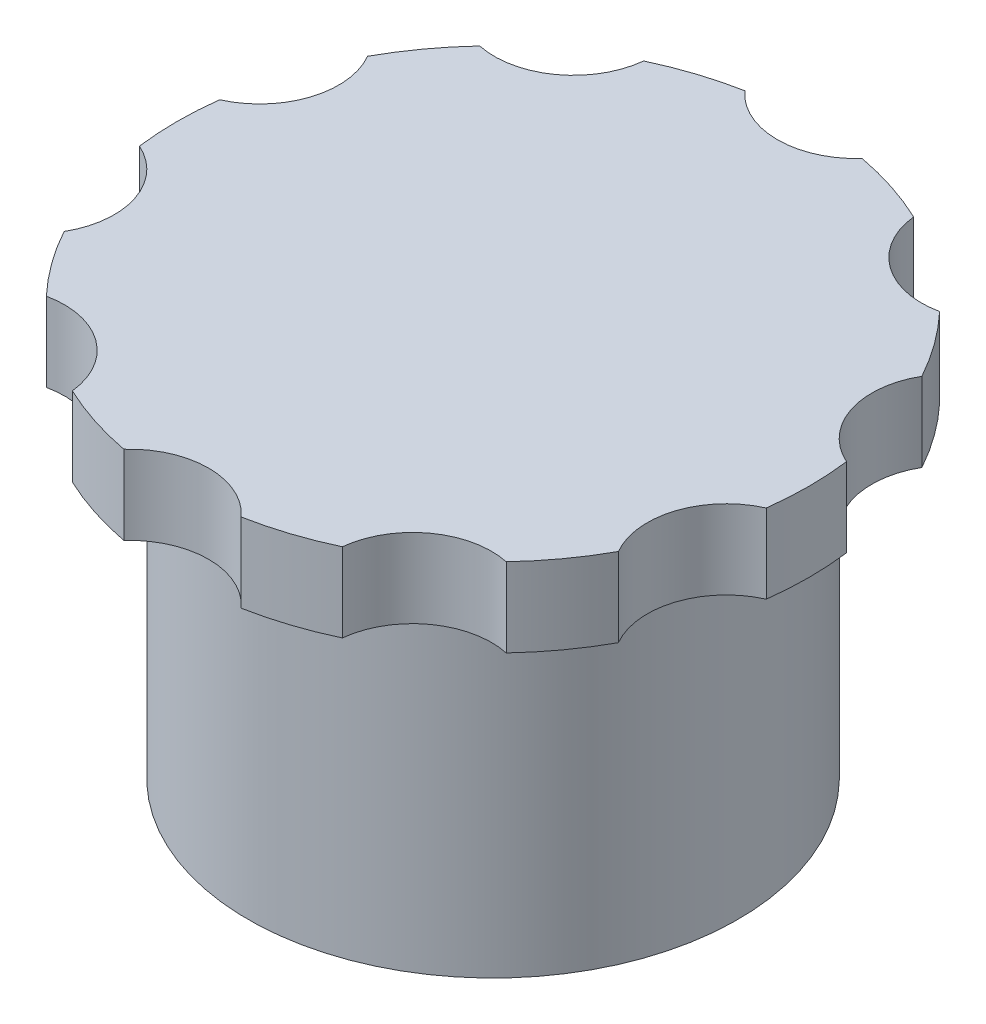
from build123d import *

# Parameters (mm, degrees)
CROQUIS1_R              = 15.5
CROQUIS1_R_2            = 10
SALIENTE_EXTRUIR1_DEPTH = 21
CROQUIS2_R              = 23
SALIENTE_EXTRUIR2_DEPTH = 5
CROQUIS3_R              = 5
CORTAR_EXTRUIR1_DEPTH   = 5
CORTAR_EXTRUIR2_START   = -5
CROQUIS4_R              = 23
CROQUIS4_R_2            = 20
CORTAR_EXTRUIR2_DEPTH   = 5


with BuildPart() as part:
    # Croquis1 → Saliente-Extruir1 (new body)
    with BuildSketch(Plane(origin=(0, 0, 0), x_dir=(1, 0, 0), z_dir=(0, 1, 0))):
        with Locations(Location((0, 0, 0), (0, 0, 90))):
            Circle(CROQUIS1_R)
        with Locations(Location((0, 0, 0), (0, 0, 90))):
            Circle(CROQUIS1_R_2, mode=Mode.SUBTRACT)
    extrude(amount=SALIENTE_EXTRUIR1_DEPTH)

    # Croquis2 → Saliente-Extruir2 (add)
    with BuildSketch(Plane(origin=(0, 21, 0), x_dir=(1, 0, 0), z_dir=(0, 1, 0))):
        with Locations(Location((0, 0, 0), (0, 0, 270))):
            Circle(CROQUIS2_R)
    extrude(amount=SALIENTE_EXTRUIR2_DEPTH)

    # Croquis3 → Cortar-Extruir1 (cut)
    with BuildSketch(Plane(origin=(0, 26, 0), x_dir=(1, 0, 0), z_dir=(0, 1, 0))):
        with Locations((0, 23)):
            Circle(CROQUIS3_R)
        with Locations((13.519060803, 18.607390871)):
            Circle(CROQUIS3_R)
        with Locations((21.874299875, 7.107390871)):
            Circle(CROQUIS3_R)
        with Locations((21.874299875, -7.107390871)):
            Circle(CROQUIS3_R)
        with Locations((13.519060803, -18.607390871)):
            Circle(CROQUIS3_R)
        with Locations((0, -23)):
            Circle(CROQUIS3_R)
        with Locations((-13.519060803, -18.607390871)):
            Circle(CROQUIS3_R)
        with Locations((-21.874299875, -7.107390871)):
            Circle(CROQUIS3_R)
        with Locations((-21.874299875, 7.107390871)):
            Circle(CROQUIS3_R)
        with Locations((-13.519060803, 18.607390871)):
            Circle(CROQUIS3_R)
    extrude(amount=-CORTAR_EXTRUIR1_DEPTH, mode=Mode.SUBTRACT)

    # Croquis4 → Cortar-Extruir2 (cut)
    with BuildSketch(Plane(origin=(0, 26, 0), x_dir=(1, 0, 0), z_dir=(0, 1, 0)).offset(CORTAR_EXTRUIR2_START)):
        Circle(CROQUIS4_R)
        Circle(CROQUIS4_R_2, mode=Mode.SUBTRACT)
    extrude(amount=CORTAR_EXTRUIR2_DEPTH, mode=Mode.SUBTRACT)


solid = part.part
